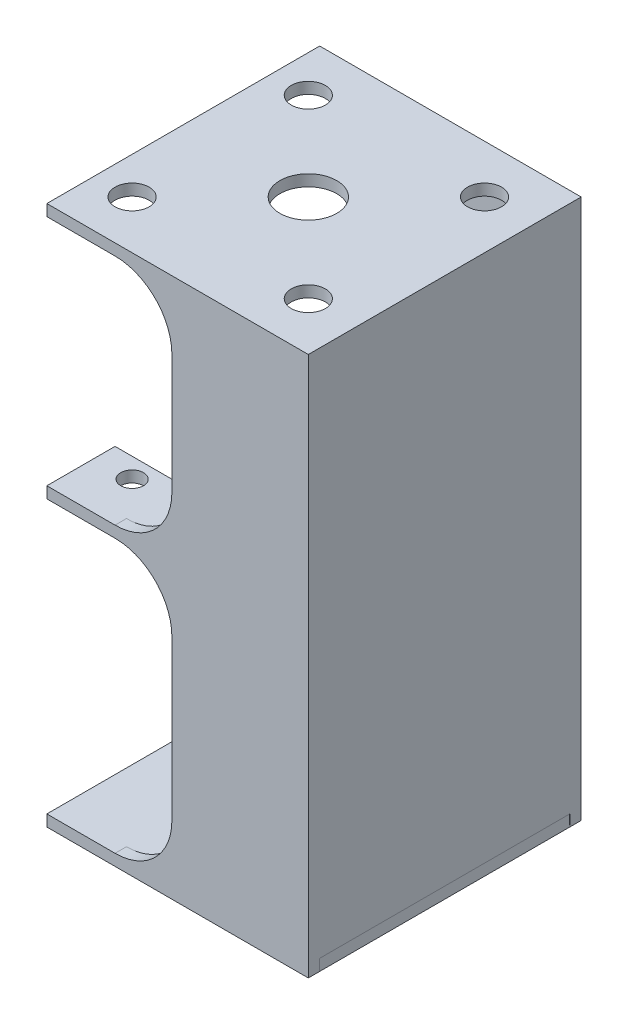
from build123d import *

# Parameters (mm, degrees)
BOSS_EXTRUDE1_DEPTH            = 48
CUT_EXTRUDE1_REACH             = 117.56
SKETCH5_R                      = 5
SKETCH5_R_2                    = 3
CUT_EXTRUDE1_DIRECTION_2_DEPTH = 116.559508479
SKETCH10_R                     = 12
SKETCH10_R_2                   = 2
CUT_EXTRUDE3_DEPTH             = 2
SKETCH15_W                     = 22
SKETCH15_H                     = 24
CUT_EXTRUDE5_DEPTH             = 2
BOSS_EXTRUDE7_DEPTH            = 93
BOSS_EXTRUDE7_DEPTH_BACK       = 2
SKETCH16_W                     = 24
SKETCH16_H                     = 2
FILLET1_R                      = 10


with BuildPart() as part:
    # Sketch1 → Boss-Extrude1 (new body)
    with BuildSketch(Plane.XY):
        Polygon((-1, 2.5), (-1, -45.5), (-45, -45.5), (-45, -47.5), (-1, -47.5), (1, -47.5), (0.957894737, -45.5), (1, -45.5), (1, 2.5), (1, 4.5), (1, 45.5), (1, 47.5), (-1, 47.5), (-45, 47.5), (-45, 45.5), (-1, 45.5), (-1, 4.5), (-45, 4.5), (-45, 2.5), align=None)
    extrude(amount=-BOSS_EXTRUDE1_DEPTH)

    # Sketch5 → Cut-Extrude1 (cut, up to next)
    with BuildSketch(Plane(origin=(0, 47.5, 0), x_dir=(1, 0, 0), z_dir=(0, 1, 0)), mode=Mode.PRIVATE) as cut_extrude1_sk1:
        with Locations(Location((-23, 24, 0), (0, 0, 90))):
            Circle(SKETCH5_R)
    cut_extrude1_tool1 = extrude(cut_extrude1_sk1.sketch, amount=-CUT_EXTRUDE1_REACH, mode=Mode.PRIVATE) & part.part
    # Sketch5 → Cut-Extrude1 (cut, up to next)
    with BuildSketch(Plane(origin=(0, 47.5, 0), x_dir=(1, 0, 0), z_dir=(0, 1, 0)), mode=Mode.PRIVATE) as cut_extrude1_sk2:
        with Locations(Location((-38.5, 39.5, 0), (0, 0, 90))):
            Circle(SKETCH5_R_2)
    cut_extrude1_tool2 = extrude(cut_extrude1_sk2.sketch, amount=-CUT_EXTRUDE1_REACH, mode=Mode.PRIVATE) & part.part
    # Sketch5 → Cut-Extrude1 (cut, up to next)
    with BuildSketch(Plane(origin=(0, 47.5, 0), x_dir=(1, 0, 0), z_dir=(0, 1, 0)), mode=Mode.PRIVATE) as cut_extrude1_sk3:
        with Locations(Location((-7.5, 39.5, 0), (0, 0, 90))):
            Circle(SKETCH5_R_2)
    cut_extrude1_tool3 = extrude(cut_extrude1_sk3.sketch, amount=-CUT_EXTRUDE1_REACH, mode=Mode.PRIVATE) & part.part
    # Sketch5 → Cut-Extrude1 (cut, up to next)
    with BuildSketch(Plane(origin=(0, 47.5, 0), x_dir=(1, 0, 0), z_dir=(0, 1, 0)), mode=Mode.PRIVATE) as cut_extrude1_sk4:
        with Locations(Location((-7.5, 8.5, 0), (0, 0, 90))):
            Circle(SKETCH5_R_2)
    cut_extrude1_tool4 = extrude(cut_extrude1_sk4.sketch, amount=-CUT_EXTRUDE1_REACH, mode=Mode.PRIVATE) & part.part
    # Sketch5 → Cut-Extrude1 (cut, up to next)
    with BuildSketch(Plane(origin=(0, 47.5, 0), x_dir=(1, 0, 0), z_dir=(0, 1, 0)), mode=Mode.PRIVATE) as cut_extrude1_sk5:
        with Locations(Location((-38.5, 8.5, 0), (0, 0, 90))):
            Circle(SKETCH5_R_2)
    cut_extrude1_tool5 = extrude(cut_extrude1_sk5.sketch, amount=-CUT_EXTRUDE1_REACH, mode=Mode.PRIVATE) & part.part
    add(cut_extrude1_tool1.solids().sort_by_distance((-23, 47.5, -24))[0], mode=Mode.SUBTRACT)
    add(cut_extrude1_tool2.solids().sort_by_distance((-38.5, 47.5, -39.5))[0], mode=Mode.SUBTRACT)
    add(cut_extrude1_tool3.solids().sort_by_distance((-7.5, 47.5, -39.5))[0], mode=Mode.SUBTRACT)
    add(cut_extrude1_tool4.solids().sort_by_distance((-7.5, 47.5, -8.5))[0], mode=Mode.SUBTRACT)
    add(cut_extrude1_tool5.solids().sort_by_distance((-38.5, 47.5, -8.5))[0], mode=Mode.SUBTRACT)

    # Sketch5 → Cut-Extrude1 direction 2 (cut)
    with BuildSketch(Plane(origin=(0, 47.5, 0), x_dir=(1, 0, 0), z_dir=(0, 1, 0))):
        with Locations(Location((-23, 24, 0), (0, 0, 90))):
            Circle(SKETCH5_R)
        with Locations(Location((-38.5, 39.5, 0), (0, 0, 90))):
            Circle(SKETCH5_R_2)
        with Locations(Location((-7.5, 39.5, 0), (0, 0, 90))):
            Circle(SKETCH5_R_2)
        with Locations(Location((-7.5, 8.5, 0), (0, 0, 90))):
            Circle(SKETCH5_R_2)
        with Locations(Location((-38.5, 8.5, 0), (0, 0, 90))):
            Circle(SKETCH5_R_2)
    extrude(amount=CUT_EXTRUDE1_DIRECTION_2_DEPTH, mode=Mode.SUBTRACT)

    # Sketch10 → Cut-Extrude3 (cut)
    with BuildSketch(Plane(origin=(0, 4.5, 0), x_dir=(1, 0, 0), z_dir=(0, 1, 0))):
        with Locations(Location((-23, 24, 0), (0, 0, 180))):
            Circle(SKETCH10_R)
        with Locations(Location((-7.5, 39.5, 0), (0, 0, 180))):
            Circle(SKETCH10_R_2)
        with Locations(Location((-7.5, 8.5, 0), (0, 0, 180))):
            Circle(SKETCH10_R_2)
        with Locations(Location((-38.5, 8.5, 0), (0, 0, 180))):
            Circle(SKETCH10_R_2)
        with Locations(Location((-38.5, 39.5, 0), (0, 0, 180))):
            Circle(SKETCH10_R_2)
    extrude(amount=-CUT_EXTRUDE3_DEPTH, mode=Mode.SUBTRACT)

    # Sketch15 → Cut-Extrude5 (cut)
    with BuildSketch(Plane(origin=(0, 4.5, 0), x_dir=(1, 0, 0), z_dir=(0, 1, 0))):
        with Locations((-34, 24)):
            Rectangle(SKETCH15_W, SKETCH15_H)
    extrude(amount=-CUT_EXTRUDE5_DEPTH, mode=Mode.SUBTRACT)

    # Sketch16 → Boss-Extrude7 (add, two sides: drawn at the far end of the back side and taken through both)
    with BuildSketch(Plane(origin=(0, -45.5, 0), x_dir=(1, 0, 0), z_dir=(0, 1, 0)).offset(-BOSS_EXTRUDE7_DEPTH_BACK)):
        with Locations((-11, 1)):
            Rectangle(SKETCH16_W, SKETCH16_H)
        with Locations((-11, 47)):
            Rectangle(SKETCH16_W, SKETCH16_H)
    extrude(amount=BOSS_EXTRUDE7_DEPTH + BOSS_EXTRUDE7_DEPTH_BACK)

    # Fillet1
    fillet1_edges = [part.edges().sort_by_distance(p)[0] for p in [
        (-23, -45.5, -1),
        (-23, 2.5, -1),
        (-23, 4.5, -1),
        (-23, 45.5, -1),
        (-23, -45.5, -47),
        (-23, 2.5, -47),
        (-23, 4.5, -47),
        (-23, 45.5, -47),
    ]]
    fillet(fillet1_edges, radius=FILLET1_R)


solid = part.part
